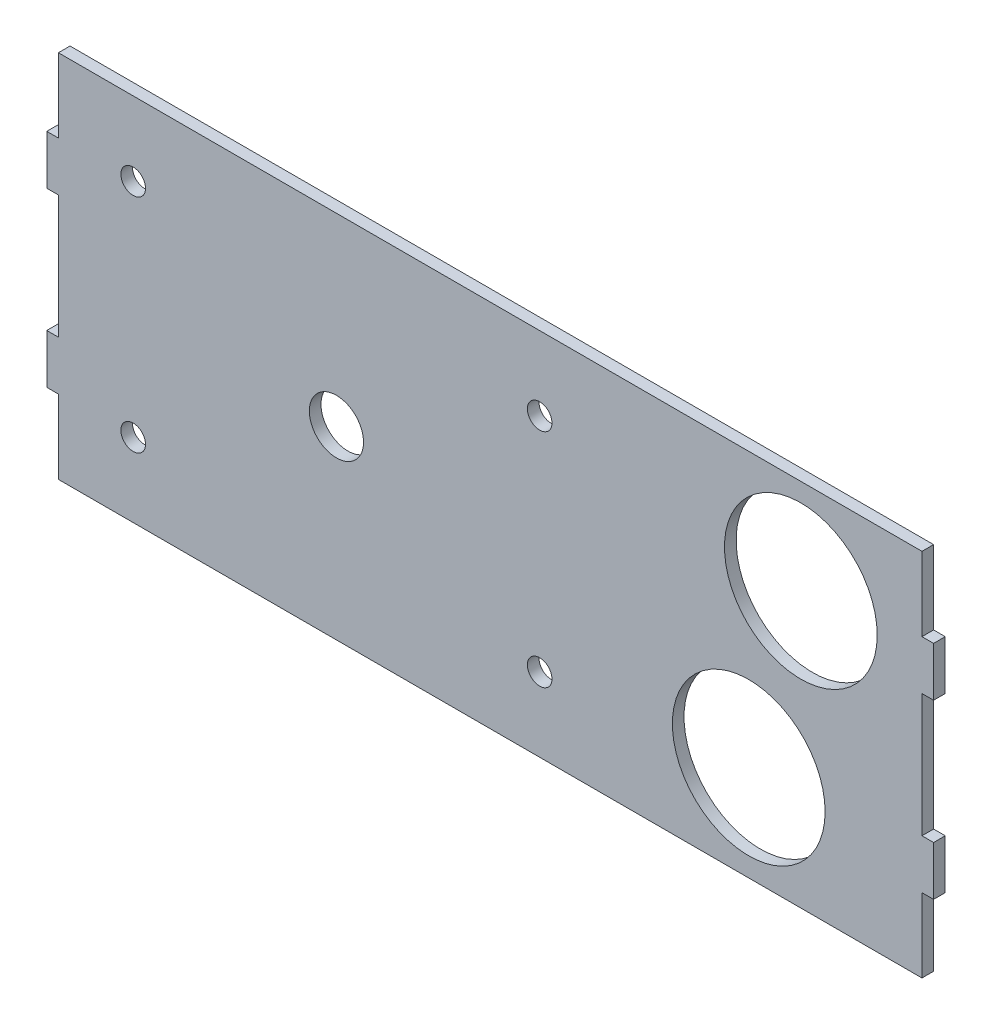
from build123d import *

# Parameters (mm, degrees)
BOSS_EXTRUDE1_DEPTH = 2.3622
SKETCH2_R           = 15.5
SKETCH2_R_2         = 5.5
SKETCH2_R_3         = 2.5
CUT_EXTRUDE1_DEPTH  = 128.843896579


with BuildPart() as part:
    # Sketch1 → Boss-Extrude1 (new body)
    with BuildSketch(Plane.XY):
        Polygon((-119.363142231, 35.994577783), (-119.363142231, 20.994577783), (-121.725342231, 20.994577783), (-121.725342231, 10.994577783), (-119.363142231, 10.994577783), (-119.363142231, -14.005422217), (-121.725342231, -14.005422217), (-121.725342231, -24.005422217), (-119.363142231, -24.005422217), (-119.363142231, -39.005422217), (55.912457769, -39.005422217), (55.912457769, -24.005422217), (58.274657769, -24.005422217), (58.274657769, -14.005422217), (55.912457769, -14.005422217), (55.912457769, 10.994577783), (58.274657769, 10.994577783), (58.274657769, 20.994577783), (55.912457769, 20.994577783), (55.912457769, 35.994577783), align=None)
    extrude(amount=BOSS_EXTRUDE1_DEPTH)

    # Sketch2 → Cut-Extrude1 (cut, through all)
    with BuildSketch(Plane.XY.offset(2.3622)):
        with Locations((31.328134445, 16.721516998)):
            Circle(SKETCH2_R)
        with Locations((20.753669958, -19.61125842)):
            Circle(SKETCH2_R)
        with Locations((-62.931965905, -1.505422217)):
            Circle(SKETCH2_R_2)
        with Locations((-104.181965905, 20.994577783)):
            Circle(SKETCH2_R_3)
        with Locations((-21.681965905, 20.994577783)):
            Circle(SKETCH2_R_3)
        with Locations((-21.681965905, -24.005422217)):
            Circle(SKETCH2_R_3)
        with Locations((-104.181965905, -24.005422217)):
            Circle(SKETCH2_R_3)
    extrude(amount=-CUT_EXTRUDE1_DEPTH, mode=Mode.SUBTRACT)


solid = part.part
